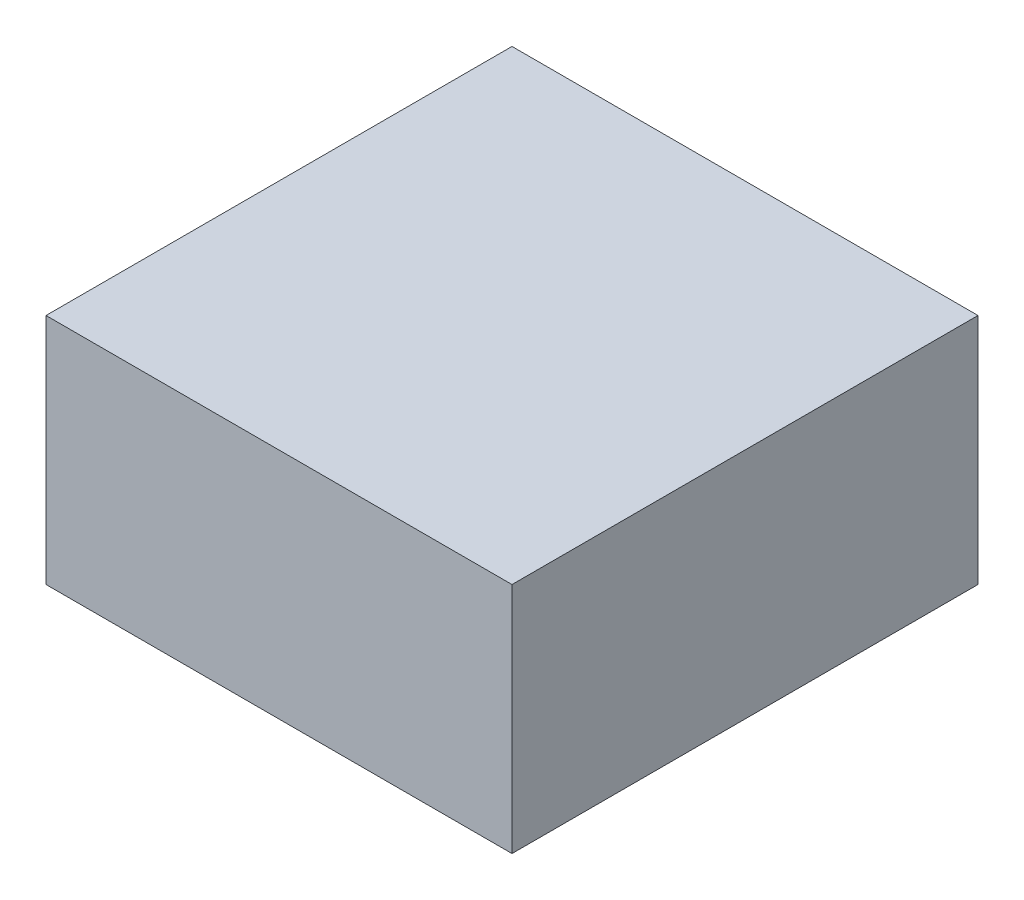
from build123d import *

# Parameters (mm, degrees)
SKETCH1_W           = 25.4
SKETCH1_H           = 25.4
BOSS_EXTRUDE1_DEPTH = 12.7


with BuildPart() as part:
    # Sketch1 → Boss-Extrude1 (new body)
    with BuildSketch(Plane(origin=(0, 0, 0), x_dir=(1, 0, 0), z_dir=(0, 1, 0))):
        Rectangle(SKETCH1_W, SKETCH1_H)
    extrude(amount=BOSS_EXTRUDE1_DEPTH)


solid = part.part
